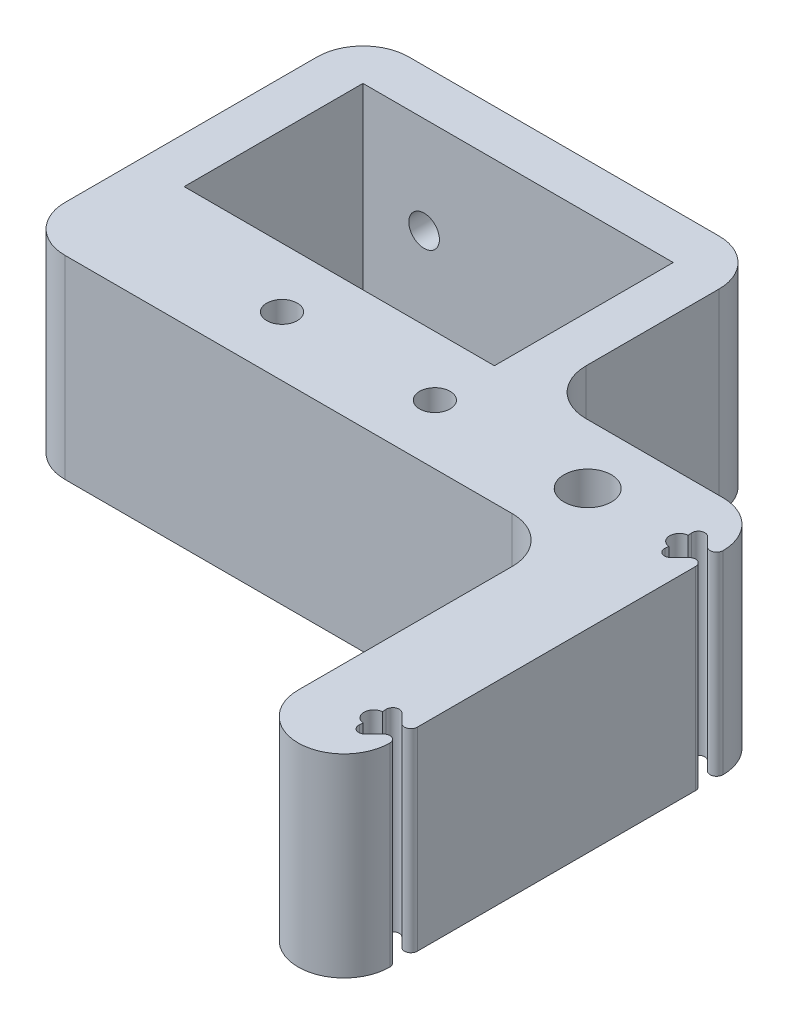
from build123d import *

# Parameters (mm, degrees)
SKETCH1_R           = 1
SKETCH1_R_2         = 1.55
SKETCH1_W           = 20.3
SKETCH1_H           = 11.7
BOSS_EXTRUDE1_DEPTH = 12.7
CUT_EXTRUDE1_REACH  = 63.983
SKETCH2_R           = 1


with BuildPart() as part:
    # Sketch1 → Boss-Extrude1 (new body)
    with BuildSketch(Plane(origin=(0, 0, 0), x_dir=(1, 0, 0), z_dir=(0, 1, 0))):
        with BuildLine():
            Line((-4.055343897, 0.632583633), (-4.075844459, 0.866906139))
            ThreePointArc((-4.075844459, 0.866906139), (-3.83530083, 1.283539926), (-3.361522369, 1.2))
            Line((-3.361522369, 1.2), (-2.761522369, 0.6))
            ThreePointArc((-2.761522369, 0.6), (-2.304491577, 0.509090923), (-2.04560443, 0.89654292))
            Line((-2.04560443, 0.89654292), (-2.04560443, 19.10345708))
            ThreePointArc((-2.04560443, 19.10345708), (-2.304491577, 19.490909077), (-2.761522369, 19.4))
            Line((-2.761522369, 19.4), (-3.361522369, 18.8))
            ThreePointArc((-3.361522369, 18.8), (-3.83530083, 18.716460074), (-4.075844459, 19.133093861))
            Line((-4.075844459, 19.133093861), (-4.055343897, 19.367416367))
            ThreePointArc((-4.055343897, 19.367416367), (-4.635, 20), (-4.055343897, 20.632583633))
            Line((-4.055343897, 20.632583633), (-4.075844459, 20.866906139))
            ThreePointArc((-4.075844459, 20.866906139), (-3.83530083, 21.283539926), (-3.361522369, 21.2))
            Line((-3.361522369, 21.2), (-2.761522369, 20.6))
            ThreePointArc((-2.761522369, 20.6), (-2.304491577, 20.509090923), (-2.04560443, 20.89654292))
            ThreePointArc((-2.04560443, 20.89654292), (-2.924284086, 23.017863263), (-5.04560443, 23.89654292))
            Line((-5.04560443, 23.89654292), (-14, 23.89654292))
            ThreePointArc((-14, 23.89654292), (-16.121320344, 24.775222576), (-17, 26.89654292))
            Line((-17, 26.89654292), (-17, 35.59654292))
            ThreePointArc((-17, 35.59654292), (-17.878679656, 37.717863263), (-20, 38.59654292))
            Line((-20, 38.59654292), (-40.3, 38.59654292))
            ThreePointArc((-40.3, 38.59654292), (-42.421320344, 37.717863263), (-43.3, 35.59654292))
            Line((-43.3, 35.59654292), (-43.3, 19.10345708))
            ThreePointArc((-43.3, 19.10345708), (-42.421320344, 16.982136737), (-40.3, 16.10345708))
            Line((-40.3, 16.10345708), (-11.04560443, 16.10345708))
            ThreePointArc((-11.04560443, 16.10345708), (-8.924284086, 15.224777424), (-8.04560443, 13.10345708))
            Line((-8.04560443, 13.10345708), (-8.04560443, -0.89654292))
            ThreePointArc((-8.04560443, -0.89654292), (-5.04560443, -3.89654292), (-2.04560443, -0.89654292))
            ThreePointArc((-2.04560443, -0.89654292), (-2.304491577, -0.509090923), (-2.761522369, -0.6))
            Line((-2.761522369, -0.6), (-3.361522369, -1.2))
            ThreePointArc((-3.361522369, -1.2), (-3.83530083, -1.283539926), (-4.075844459, -0.866906139))
            Line((-4.075844459, -0.866906139), (-4.055343897, -0.632583633))
            ThreePointArc((-4.055343897, -0.632583633), (-4.635, 0), (-4.055343897, 0.632583633))
        make_face()
        with Locations(Location((-20, 20, 0), (0, 0, 270))):
            Circle(SKETCH1_R, mode=Mode.SUBTRACT)
        with Locations(Location((-10, 20, 0), (0, 0, 270))):
            Circle(SKETCH1_R_2, mode=Mode.SUBTRACT)
        with Locations(Location((-30, 20, 0), (0, 0, 270))):
            Circle(SKETCH1_R, mode=Mode.SUBTRACT)
        with Locations((-30.15, 29.74654292)):
            Rectangle(SKETCH1_W, SKETCH1_H, mode=Mode.SUBTRACT)
    extrude(amount=BOSS_EXTRUDE1_DEPTH)

    # Sketch2 → Cut-Extrude1 (cut, up to next)
    with BuildSketch(Plane(origin=(0, 0, -38.59654292), x_dir=(-1, 0, 0), z_dir=(0, 0, -1)), mode=Mode.PRIVATE) as cut_extrude1_sk1:
        with Locations((36.3, 6.35)):
            Circle(SKETCH2_R)
    cut_extrude1_tool1 = extrude(cut_extrude1_sk1.sketch, amount=-CUT_EXTRUDE1_REACH, mode=Mode.PRIVATE) & part.part
    # Sketch2 → Cut-Extrude1 (cut, up to next)
    with BuildSketch(Plane(origin=(0, 0, -38.59654292), x_dir=(-1, 0, 0), z_dir=(0, 0, -1)), mode=Mode.PRIVATE) as cut_extrude1_sk2:
        with Locations((24, 6.35)):
            Circle(SKETCH2_R)
    cut_extrude1_tool2 = extrude(cut_extrude1_sk2.sketch, amount=-CUT_EXTRUDE1_REACH, mode=Mode.PRIVATE) & part.part
    add(cut_extrude1_tool1.solids().sort_by_distance((-36.3, 6.35, -38.596543))[0], mode=Mode.SUBTRACT)
    add(cut_extrude1_tool2.solids().sort_by_distance((-24, 6.35, -38.596543))[0], mode=Mode.SUBTRACT)


solid = part.part
